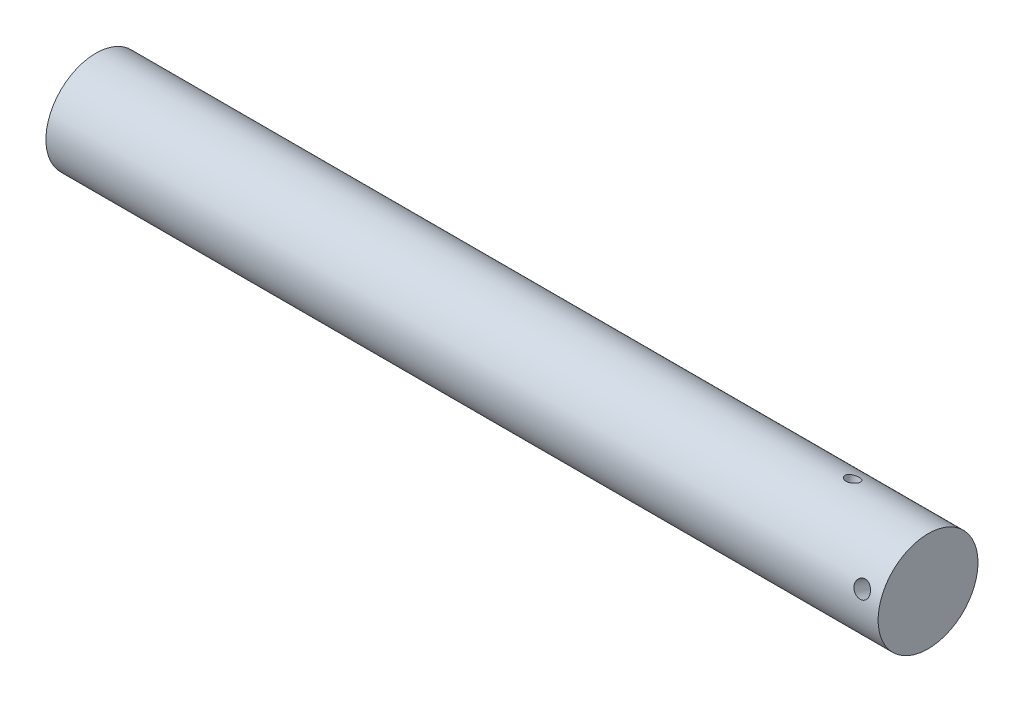
from build123d import *

# Parameters (mm, degrees)
SKETCH1_R                       = 7.5
BOSS_EXTRUDE1_DEPTH             = 125
F_3_32_0_09375_DIAMETER_HOLE1_D = 2.38125
F_2MM_DIAMETER_HOLE_D           = 2


with BuildPart() as part:
    # Sketch1 → Boss-Extrude1 (new body)
    with BuildSketch(Plane(origin=(0, 0, 0), x_dir=(0, 0, -1), z_dir=(1, 0, 0))):
        Circle(SKETCH1_R)
    extrude(amount=BOSS_EXTRUDE1_DEPTH)

    # 3/32 (0.09375) Diameter Hole1 (through all)
    with Locations(Plane(origin=(122.197095896, -2.4168895, -7.099904587), x_dir=(0, -0.946653944928, 0.322251933358), z_dir=(0, -0.322251933358, -0.946653944928))):
        with Locations((0, 0)):
            Hole(F_3_32_0_09375_DIAMETER_HOLE1_D / 2)

    # 2mm Diameter Hole (through all)
    with Locations(Plane(origin=(112.009618943, 7.312828958, -1.665092378), x_dir=(0, 0.222012317051, 0.975043861105), z_dir=(0, 0.975043861105, -0.222012317051))):
        with Locations((0, 0)):
            Hole(F_2MM_DIAMETER_HOLE_D / 2)


solid = part.part
